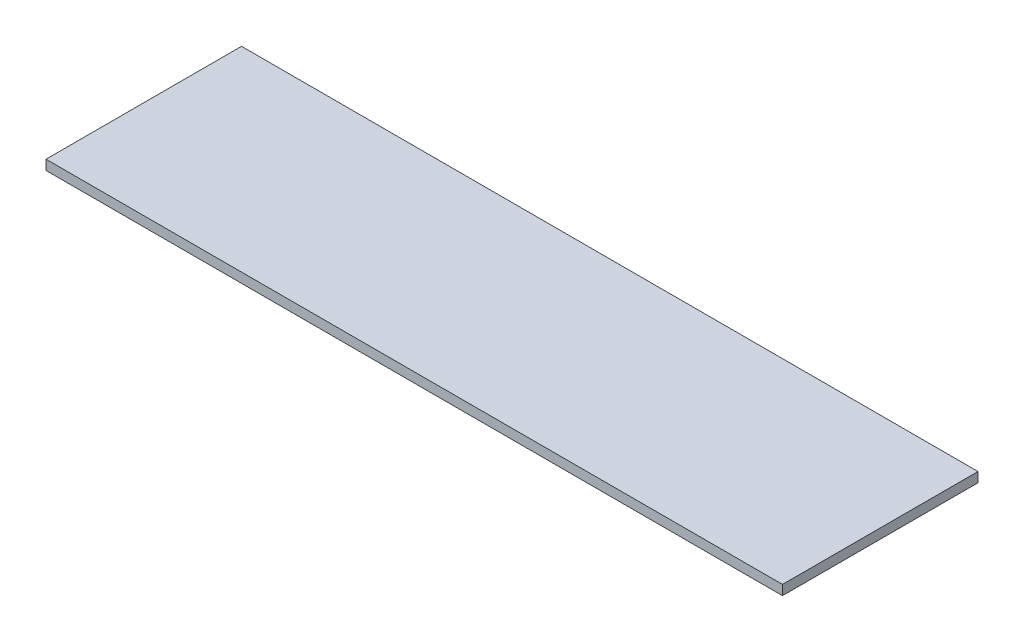
from build123d import *

# Parameters (mm, degrees)
SKETCH_1_W      = 226
SKETCH_1_H      = 60
EXTRUDE_1_DEPTH = 3


with BuildPart() as part:
    # 草图1 → 凸台-拉伸1 (new body)
    with BuildSketch(Plane(origin=(0, 0, 0), x_dir=(1, 0, 0), z_dir=(0, 1, 0))):
        with Locations((113, -30)):
            Rectangle(SKETCH_1_W, SKETCH_1_H)
    extrude(amount=EXTRUDE_1_DEPTH)


solid = part.part
